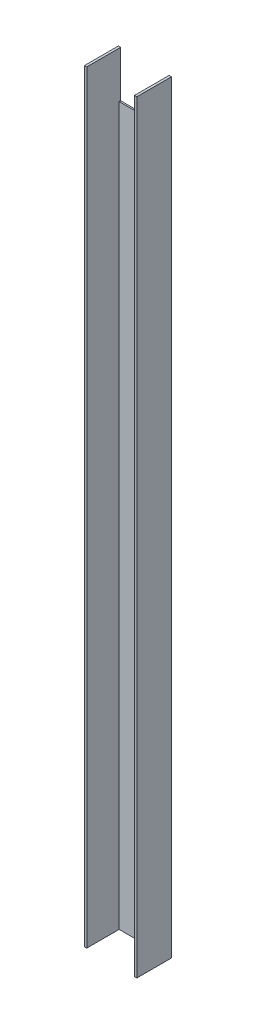
from build123d import *

# Parameters (mm, degrees)
BOSS_EXTRUDE2_DEPTH = 330
SKETCH3_W           = 21
SKETCH3_H           = 0.644349626
CUT_EXTRUDE1_DEPTH  = 20


with BuildPart() as part:
    # Sketch2 → Boss-Extrude2 (new body)
    with BuildSketch(Plane(origin=(0, 0, 0), x_dir=(1, 0, 0), z_dir=(0, 1, 0))):
        Polygon((-11.362031741, -7.234328925), (-11.362031741, 7.410020701), (11.637968259, 7.410020701), (11.637968259, -7.589979299), (10.625971019, -7.589979299), (10.625971019, 6.765671075), (-10.374028981, 6.765671075), (-10.374028981, -7.234328925), align=None)
    extrude(amount=BOSS_EXTRUDE2_DEPTH)

    # Sketch3 → Cut-Extrude1 (cut)
    with BuildSketch(Plane(origin=(0, 330, 0), x_dir=(1, 0, 0), z_dir=(0, 1, 0))):
        with Locations((0.125971019, 7.087845888)):
            Rectangle(SKETCH3_W, SKETCH3_H)
    extrude(amount=-CUT_EXTRUDE1_DEPTH, mode=Mode.SUBTRACT)


solid = part.part
